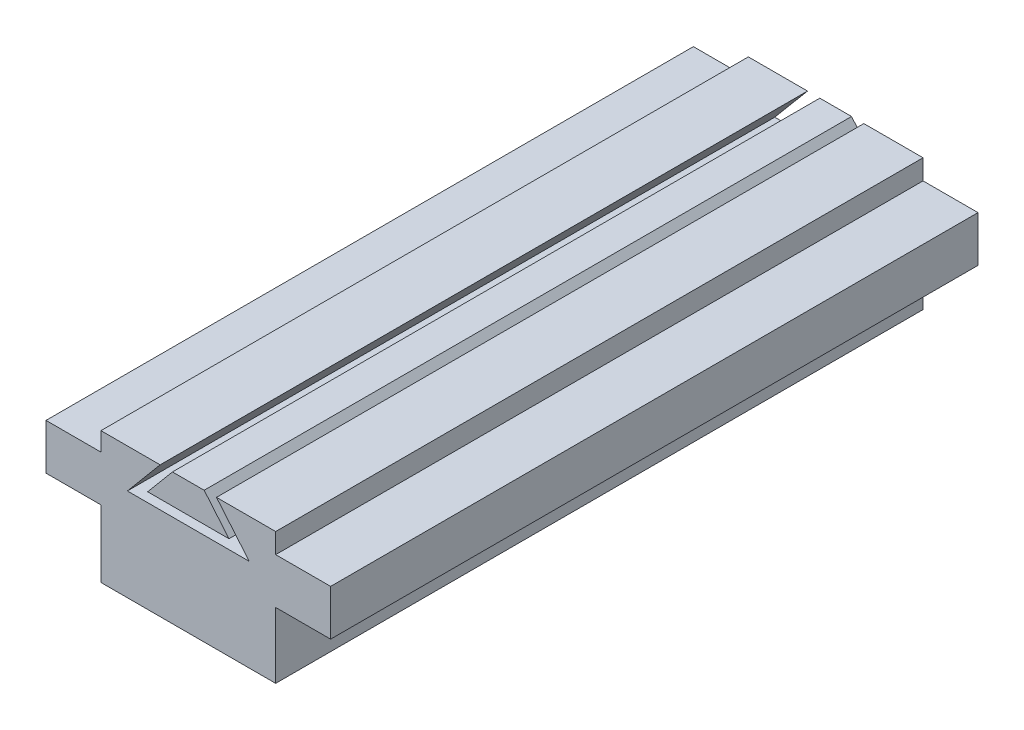
from build123d import *

# Parameters (mm, degrees)
BOSS_EXTRUDE1_DEPTH = 17.5
BOSS_EXTRUDE2_DEPTH = 17.5
SKETCH5_W           = 1.485390476
SKETCH5_H           = 1.235647008
BOSS_EXTRUDE3_DEPTH = 17.5
SKETCH6_R           = 0.677079947
CUT_EXTRUDE1_DEPTH  = 2.50000008


with BuildPart() as part:
    # Sketch1 → Boss-Extrude1 (new body)
    with BuildSketch(Plane.XY):
        Polygon((-0.428720295, 0), (0.428720295, 0), (1.1, -0.8), (-1.1, -0.8), align=None)
    extrude(amount=BOSS_EXTRUDE1_DEPTH)


with BuildPart() as body_2:
    # Sketch4 → Boss-Extrude2 (new body)
    with BuildSketch(Plane.XY.offset(17.5)):
        Polygon((-0.761599151, 0), (-1.64684926, -1.054999998), (1.64684926, -1.054999998), (0.761599151, 0), (2.361595951, 0), (2.361595951, -3.555000078), (-2.361595951, -3.555000078), (-2.361595951, 0), align=None)
    extrude(amount=-BOSS_EXTRUDE2_DEPTH)

    # Sketch5 → Boss-Extrude3 (add)
    with BuildSketch(Plane.XY.offset(17.5)):
        with Locations((-3.104291189, -1.120453231)):
            Rectangle(SKETCH5_W, SKETCH5_H)
        with Locations((3.104291189, -1.159203088)):
            Rectangle(SKETCH5_W, SKETCH5_H)
    extrude(amount=-BOSS_EXTRUDE3_DEPTH)

    # Sketch6 → Cut-Extrude1 (cut)
    with BuildSketch(Plane.XZ.offset(3.555000078)):
        with Locations((0, 16.087014181)):
            Circle(SKETCH6_R)
        with Locations((0, 12.277014181)):
            Circle(SKETCH6_R)
        with Locations((0, 8.467014181)):
            Circle(SKETCH6_R)
        with Locations((0, 4.657014181)):
            Circle(SKETCH6_R)
    extrude(amount=-CUT_EXTRUDE1_DEPTH, mode=Mode.SUBTRACT)


solid = Compound([part.part, body_2.part])
